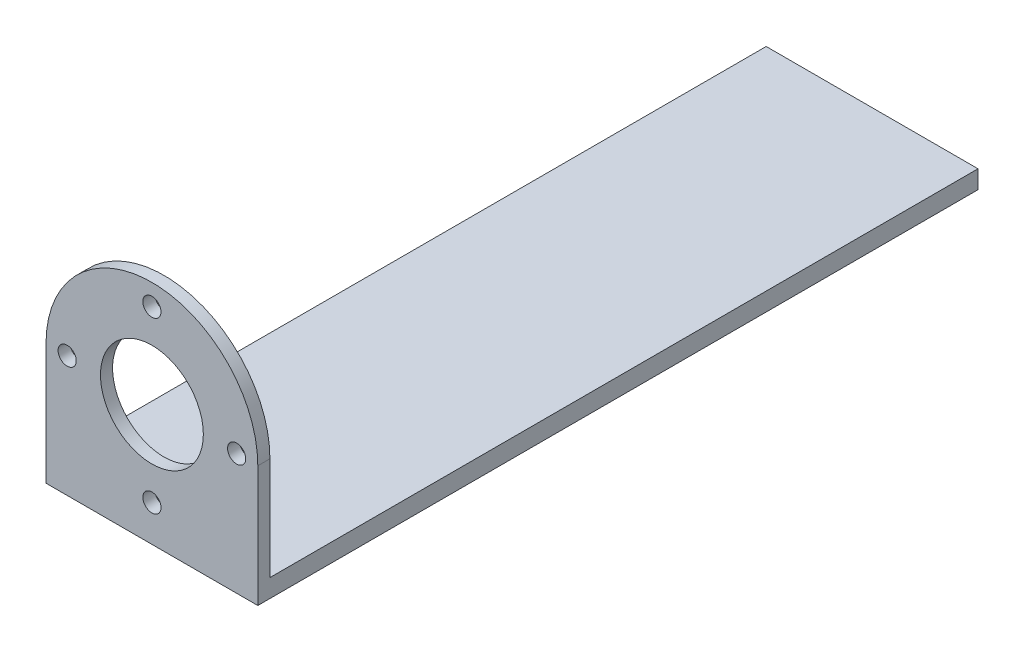
from build123d import *

# Parameters (mm, degrees)
SKETCH1_R           = 1.5
SKETCH1_R_2         = 8.5
BOSS_EXTRUDE1_DEPTH = 2
SKETCH2_W           = 35
SKETCH2_H           = 3
BOSS_EXTRUDE2_DEPTH = 117


with BuildPart() as part:
    # Sketch1 → Boss-Extrude1 (new body)
    with BuildSketch(Plane.XY):
        with BuildLine():
            Line((-17.5, 0), (-17.5, -20))
            Line((-17.5, -20), (17.5, -20))
            Line((17.5, -20), (17.5, 0))
            ThreePointArc((17.5, 0), (0, 17.5), (-17.5, 0))
        make_face()
        with Locations((0, 14)):
            Circle(SKETCH1_R, mode=Mode.SUBTRACT)
        with Locations((14, 0)):
            Circle(SKETCH1_R, mode=Mode.SUBTRACT)
        with Locations((0, -14)):
            Circle(SKETCH1_R, mode=Mode.SUBTRACT)
        with Locations((-14, 0)):
            Circle(SKETCH1_R, mode=Mode.SUBTRACT)
        Circle(SKETCH1_R_2, mode=Mode.SUBTRACT)
    extrude(amount=BOSS_EXTRUDE1_DEPTH)

    # Sketch2 → Boss-Extrude2 (add)
    with BuildSketch(Plane(origin=(0, 0, 0), x_dir=(-1, 0, 0), z_dir=(0, 0, -1))):
        with Locations((0, -18.5)):
            Rectangle(SKETCH2_W, SKETCH2_H)
    extrude(amount=BOSS_EXTRUDE2_DEPTH)


solid = part.part
